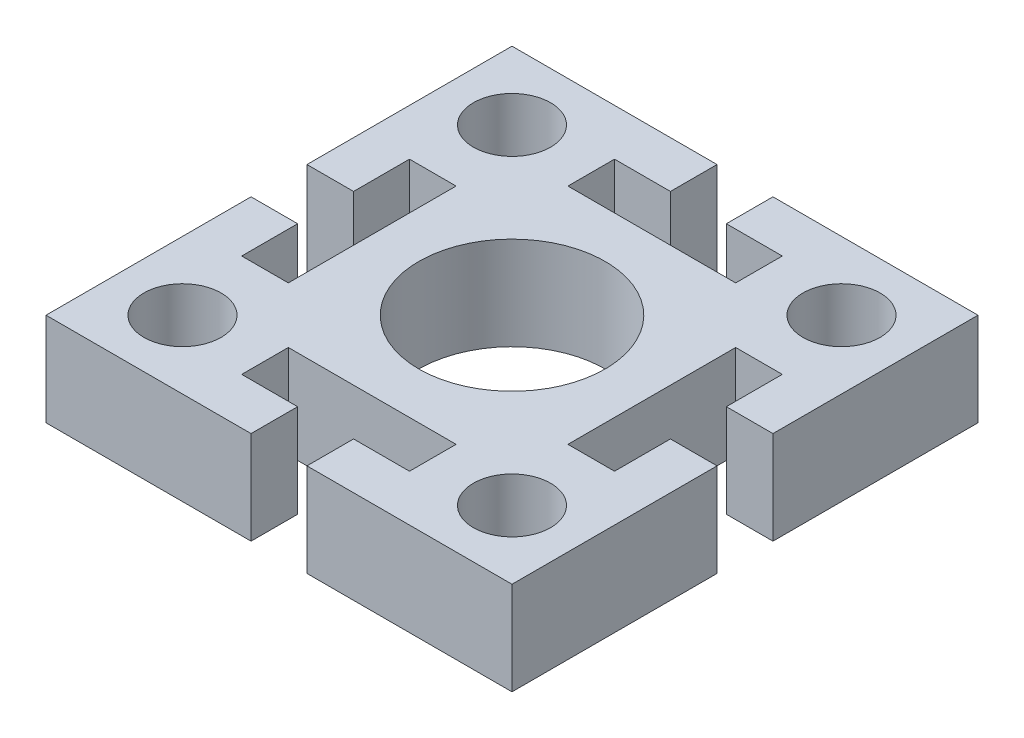
from build123d import *

# Parameters (mm, degrees)
SKETCH1_R           = 10
SKETCH1_R_2         = 4.138691164
BOSS_EXTRUDE1_DEPTH = 10


with BuildPart() as part:
    # Sketch1 → Boss-Extrude1 (new body)
    with BuildSketch(Plane(origin=(0, 0, 0), x_dir=(1, 0, 0), z_dir=(0, 1, 0))):
        Polygon((-25, -3), (-25, -25), (-3, -25), (-3, -20), (-9, -20), (-9, -15), (9, -15), (9, -20), (3, -20), (3, -25), (25, -25), (25, -3), (20, -3), (20, -9), (15, -9), (15, 9), (20, 9), (20, 3), (25, 3), (25, 25), (3, 25), (3, 20), (9, 20), (9, 15), (-9, 15), (-9, 20), (-3, 20), (-3, 25), (-25, 25), (-25, 3), (-20, 3), (-20, 9), (-15, 9), (-15, -9), (-20, -9), (-20, -3), align=None)
        with Locations(Location((0, 0, 0), (0, 0, 270))):
            Circle(SKETCH1_R, mode=Mode.SUBTRACT)
        with Locations(Location((-17.67766953, 17.67766953, 0), (0, 0, 270))):
            Circle(SKETCH1_R_2, mode=Mode.SUBTRACT)
        with Locations(Location((17.67766953, 17.67766953, 0), (0, 0, 270))):
            Circle(SKETCH1_R_2, mode=Mode.SUBTRACT)
        with Locations(Location((17.67766953, -17.67766953, 0), (0, 0, 270))):
            Circle(SKETCH1_R_2, mode=Mode.SUBTRACT)
        with Locations(Location((-17.67766953, -17.67766953, 0), (0, 0, 270))):
            Circle(SKETCH1_R_2, mode=Mode.SUBTRACT)
    extrude(amount=BOSS_EXTRUDE1_DEPTH)


solid = part.part
